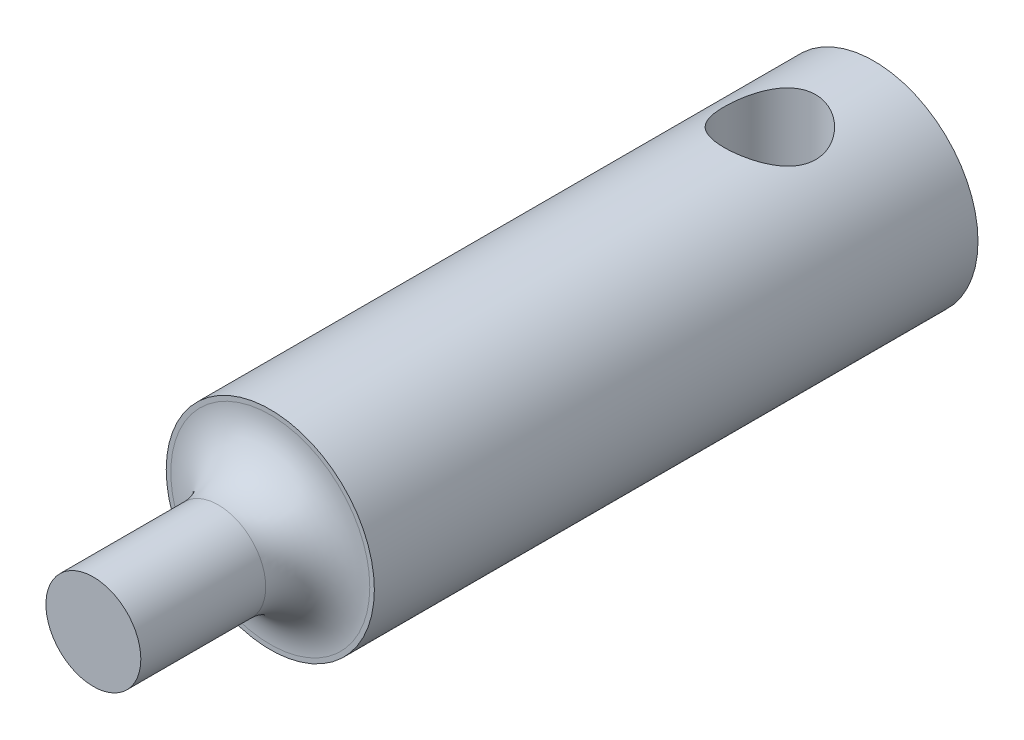
from build123d import *

# Parameters (mm, degrees)
SKETCH1_R               = 3.175
BOSS_EXTRUDE1_DEPTH     = 18.415
SKETCH2_R               = 1.4478
BOSS_EXTRUDE2_DEPTH     = 5.3975
FILLET1_R               = 1.5875
CUT_EXTRUDE1_DEPTH      = 25.232135817
CUT_EXTRUDE1_DEPTH_BACK = 25.232135817
SKETCH3_R               = 1.397


with BuildPart() as part:
    # Sketch1 → Boss-Extrude1 (new body)
    with BuildSketch(Plane.XY):
        Circle(SKETCH1_R)
    extrude(amount=BOSS_EXTRUDE1_DEPTH)

    # Sketch2 → Boss-Extrude2 (add)
    with BuildSketch(Plane.XY.offset(18.415)):
        Circle(SKETCH2_R)
    extrude(amount=BOSS_EXTRUDE2_DEPTH)

    # Fillet1
    fillet1_edges = [part.edges().sort_by_distance(p)[0] for p in [
        (-1.4478, 0, 18.415),
    ]]
    fillet(fillet1_edges, radius=FILLET1_R)

    # Sketch3 → Cut-Extrude1 (cut, two sides: drawn at the far end of the back side and taken through both)
    with BuildSketch(Plane(origin=(0, 0, 0), x_dir=(1, 0, 0), z_dir=(0, 1, 0)).offset(-CUT_EXTRUDE1_DEPTH_BACK)):
        with Locations(Location((0, -3.175, 0), (0, 0, 270))):
            Circle(SKETCH3_R)
    extrude(amount=CUT_EXTRUDE1_DEPTH + CUT_EXTRUDE1_DEPTH_BACK, mode=Mode.SUBTRACT)


solid = part.part
